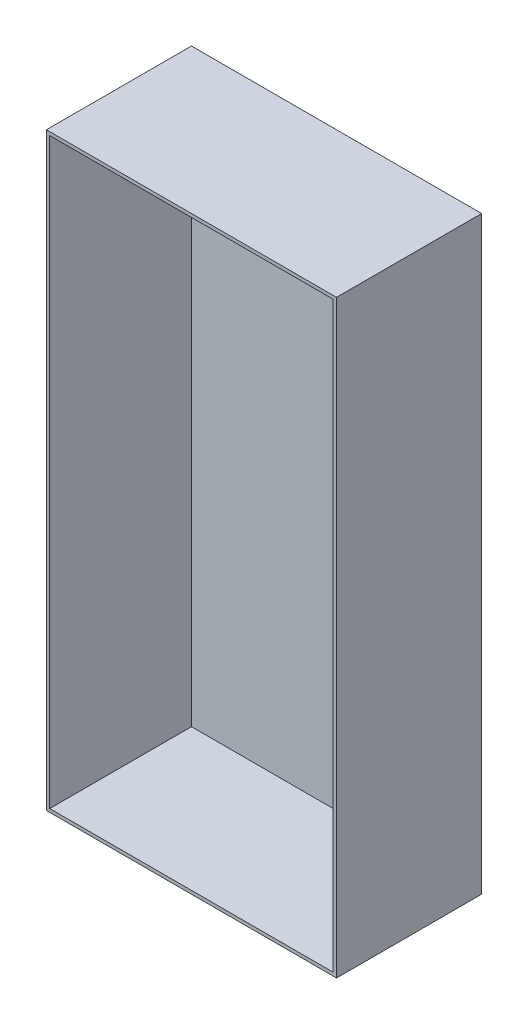
from build123d import *

# Parameters (mm, degrees)
SKETCH1_W           = 353.5
SKETCH1_H           = 174
BOSS_EXTRUDE1_DEPTH = 87
SHELL1_T            = -2


with BuildPart() as part:
    # Sketch1 → Boss-Extrude1 (new body)
    with BuildSketch(Plane(origin=(0, 0, 0), x_dir=(0, 1, 0), z_dir=(0, 0, 1))):
        with Locations((0, -37)):
            Rectangle(SKETCH1_W, SKETCH1_H)
    extrude(amount=BOSS_EXTRUDE1_DEPTH)

    # Shell1
    shell1_openings = [part.faces().sort_by_distance(p)[0] for p in [
        (37, 0, 87),
    ]]
    offset(amount=SHELL1_T, openings=shell1_openings, kind=Kind.INTERSECTION)


solid = part.part
